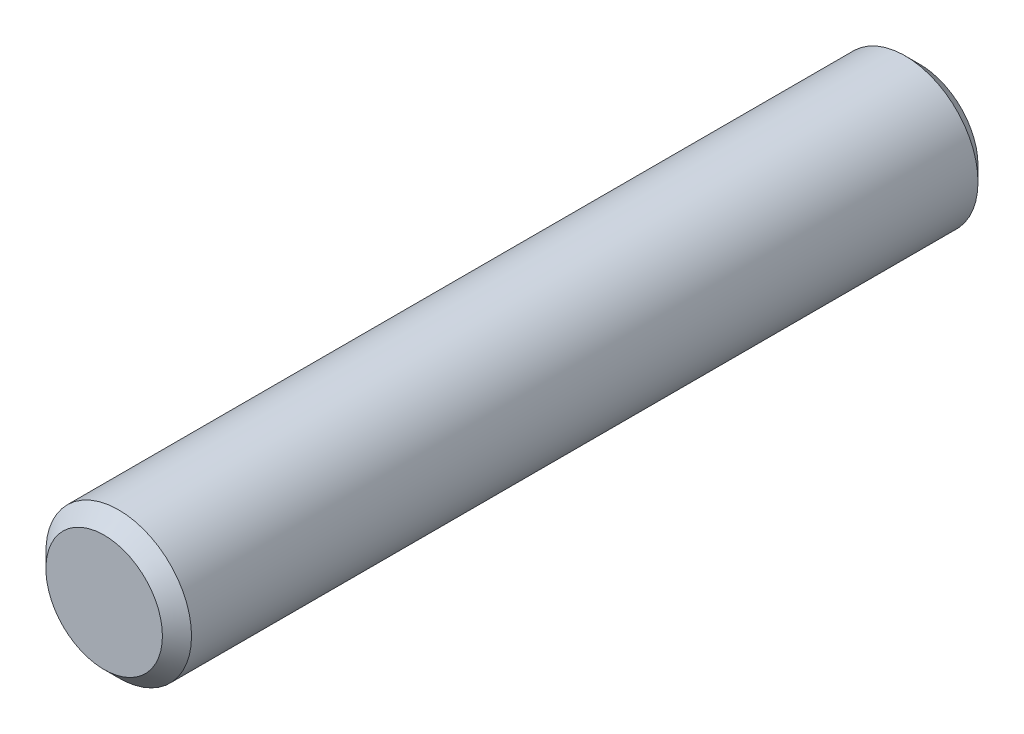
from build123d import *

# Parameters (mm, degrees)
SKETCH1_R           = 2.5
BOSS_EXTRUDE1_DEPTH = 28
CHAMFER1_SIZE       = 0.5


with BuildPart() as part:
    # Sketch1 → Boss-Extrude1 (new body)
    with BuildSketch(Plane.XY):
        Circle(SKETCH1_R)
    extrude(amount=BOSS_EXTRUDE1_DEPTH)

    # Chamfer1
    chamfer1_edges = [part.edges().sort_by_distance(p)[0] for p in [
        (-2.5, 0, 0),
        (-2.5, 0, 28),
    ]]
    chamfer(chamfer1_edges, length=CHAMFER1_SIZE)


solid = part.part
